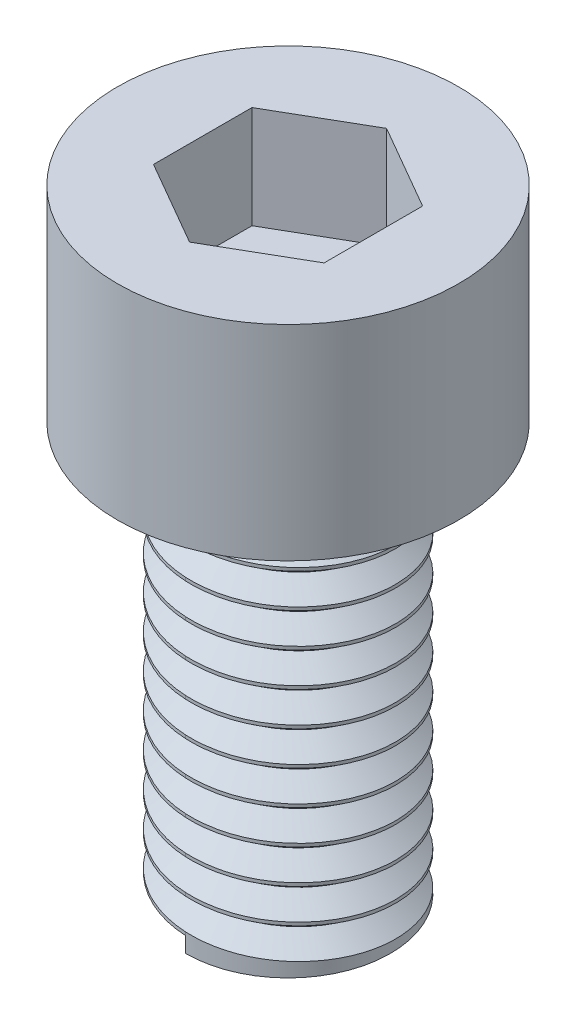
from build123d import *

# Parameters (mm, degrees)
SK_CABEZA_R         = 5
CABEZA_DEPTH        = 6
CANA_START          = -12
SK_CANA_R           = 3
CANA_DEPTH          = 12
HUECO_ALLEN_DEPTH   = 3
ROSCA_M6X1_0_PITCH  = 1
ROSCA_M6X1_0_HEIGHT = 11.4
ROSCA_M6X1_0_RADIUS = 3


with BuildPart() as part:
    # Sk_Cabeza → Cabeza (new body)
    with BuildSketch(Plane(origin=(0, 0, 0), x_dir=(1, 0, 0), z_dir=(0, 1, 0))):
        with Locations(Location((0, 0, 0), (0, 0, 270))):
            Circle(SK_CABEZA_R)
    extrude(amount=CABEZA_DEPTH)

    # Sk_Cana → Cana (add)
    with BuildSketch(Plane(origin=(0, 0, 0), x_dir=(1, 0, 0), z_dir=(0, 1, 0)).offset(CANA_START)):
        with Locations(Location((0, 0, 0), (0, 0, 270))):
            Circle(SK_CANA_R)
    extrude(amount=CANA_DEPTH)

    # Sk_Hueco_Allen → Hueco_Allen (cut)
    with BuildSketch(Plane(origin=(0, 6, 0), x_dir=(1, 0, 0), z_dir=(0, 1, 0))):
        Polygon((2.5, -1.443375673), (0, -2.886751346), (-2.5, -1.443375673), (-2.5, 1.443375673), (0, 2.886751346), (2.5, 1.443375673), align=None)
    extrude(amount=-HUECO_ALLEN_DEPTH, mode=Mode.SUBTRACT)

    # Rosca_M6x1,0: sweep along a helix
    with BuildLine() as rosca_m6x1_0_path:
        Helix(ROSCA_M6X1_0_PITCH, ROSCA_M6X1_0_HEIGHT, ROSCA_M6X1_0_RADIUS, center=(0, -12, 0), direction=(0, 1, 0), lefthand=True)
    # Sk_Perfil_rosca → Rosca_M6x1,0 (sweep, cut)
    with BuildSketch(Plane(origin=(0, 0, 0), x_dir=(0, 0, -1), z_dir=(1, 0, 0))):
        Polygon((-3.2, -12.6), (-2.3866, -12), (-3.2, -11.4), align=None)
    sweep(path=rosca_m6x1_0_path.line, is_frenet=True, mode=Mode.SUBTRACT)


solid = part.part
